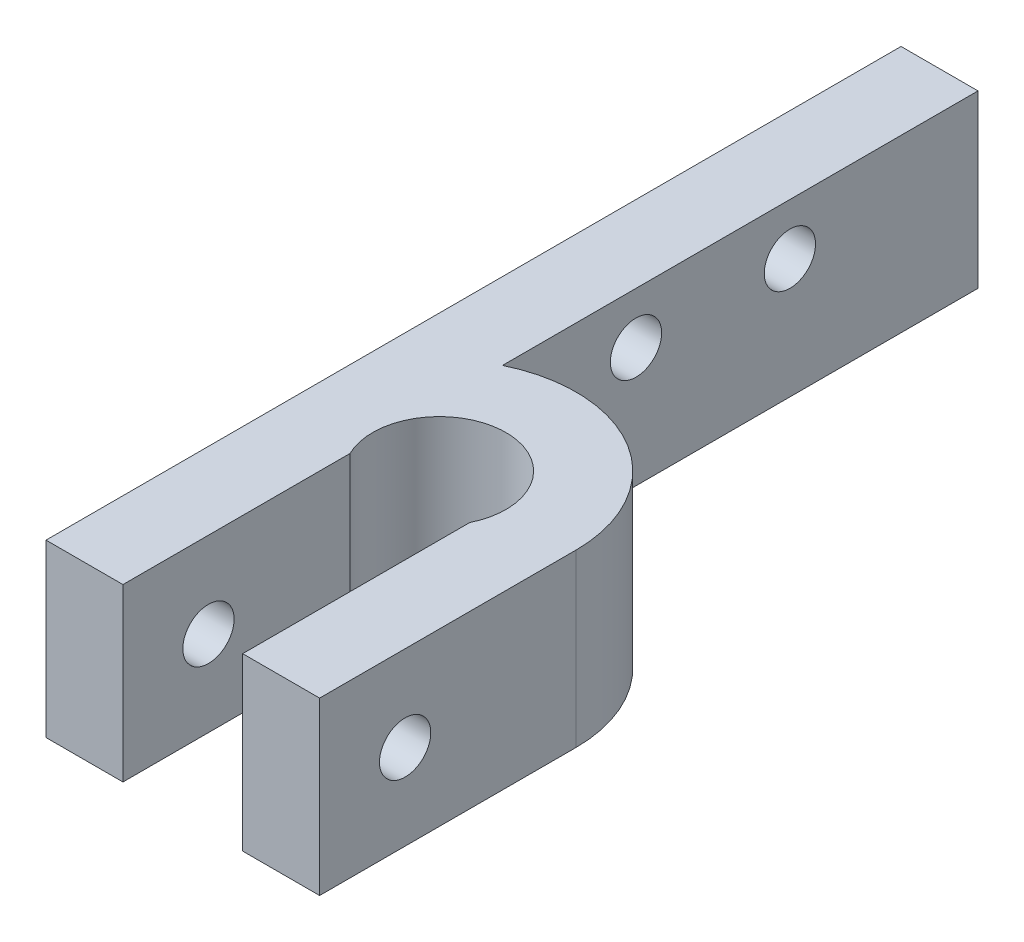
from build123d import *

# Parameters (mm, degrees)
BOSS_EXTRUDE1_DEPTH = 10
SKETCH2_R           = 1.5
CUT_EXTRUDE1_DEPTH  = 40.761790704
SKETCH3_R           = 1.5
CUT_EXTRUDE2_DEPTH  = 40.761790704


with BuildPart() as part:
    # Sketch1 → Boss-Extrude1 (new body)
    with BuildSketch(Plane(origin=(0, 0, 0), x_dir=(1, 0, 0), z_dir=(0, 1, 0))):
        with BuildLine():
            Line((-8, -15), (-8, 35))
            Line((-8, 35), (-3.5, 35))
            Line((-3.5, 35), (-3.5, 7.193747285))
            ThreePointArc((-3.5, 7.193747285), (4.242640687, 6.782329983), (8, 0))
            Line((8, 0), (8, -15))
            Line((8, -15), (3.5, -15))
            Line((3.5, -15), (3.5, -1.720465053))
            ThreePointArc((3.5, -1.720465053), (0, 3.9), (-3.5, -1.720465053))
            Line((-3.5, -1.720465053), (-3.5, -15))
            Line((-3.5, -15), (-8, -15))
        make_face()
    extrude(amount=BOSS_EXTRUDE1_DEPTH)

    # Sketch2 → Cut-Extrude1 (cut, through all)
    with BuildSketch(Plane.ZY.offset(8)):
        with Locations((10, 5)):
            Circle(SKETCH2_R)
    extrude(amount=-CUT_EXTRUDE1_DEPTH, mode=Mode.SUBTRACT)

    # Sketch3 → Cut-Extrude2 (cut, through all)
    with BuildSketch(Plane.ZY.offset(8)):
        with Locations((-24, 7)):
            Circle(SKETCH3_R)
        with Locations((-15, 7)):
            Circle(SKETCH3_R)
    extrude(amount=-CUT_EXTRUDE2_DEPTH, mode=Mode.SUBTRACT)


solid = part.part
